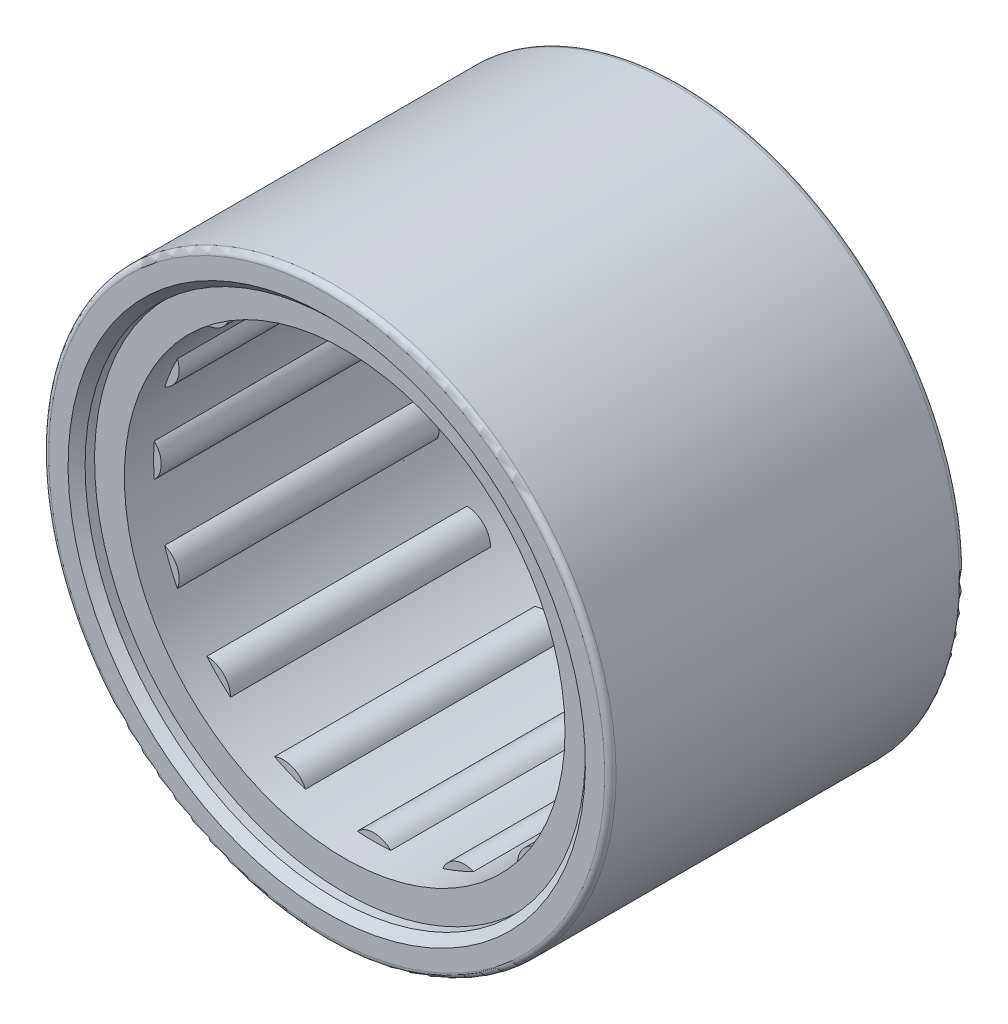
from build123d import *
from build123d.topology import SkipClean

# Parameters (mm, degrees)
SKETCH2_W           = 11.641666666
SKETCH2_H           = 0.79375
SKETCH3_W           = 13.758333334
SKETCH3_H           = 0.264583334
CIRPATTERN1_COUNT   = 16
CIRPATTERN1_ANGLE   = 337.5
FILLET1_R           = 0.254
SKETCH7_R           = 11.641666667
SKETCH7_R_2         = 9.863666667
BOSS_EXTRUDE1_DEPTH = 13.758333333
SKETCH8_R           = 11.197166667
CUT_EXTRUDE1_DEPTH  = 24.970724451
CHAMFER1_SIZE       = 0.381
BOSS_EXTRUDE3_START = 0.254
SKETCH10_R          = 11.197166667
SKETCH10_R_2        = 9.863666667
BOSS_EXTRUDE3_DEPTH = 0.254
CUT_EXTRUDE2_DEPTH  = 11.641666667
CIRPATTERN2_COUNT   = 16
BOSS_EXTRUDE4_START = -1.058333
SKETCH12_R          = 11.197166667
SKETCH12_R_2        = 9.863666667
BOSS_EXTRUDE4_DEPTH = 1.058333


with BuildPart() as part:
    # Sketch1 → Revolve1 (revolve)
    with BuildSketch(Plane(origin=(0, 0, 0), x_dir=(0, 0, -1), z_dir=(1, 0, 0)), mode=Mode.PRIVATE) as revolve1_sk:
        Polygon((-7.9375, 12.7), (7.9375, 12.7), (7.9375, 10.054166667), (6.879166667, 10.054166667), (6.879166667, 11.641666667), (-6.879166667, 11.641666667), (-6.879166667, 10.054166667), (-7.9375, 10.054166667), align=None)
    revolve(revolve1_sk.sketch.rotate(Axis((0, 0, 7.9375), (0, 0, -1)), 180), axis=Axis((0, 0, 7.9375), (0, 0, -1)))

    # Fillet1
    fillet1_edges = [part.edges().sort_by_distance(p)[0] for p in [
        (0, 12.7, 7.9375),
        (0, 12.7, -7.9375),
    ]]
    fillet(fillet1_edges, radius=FILLET1_R)

    # Sketch8 → Cut-Extrude1 (cut, through all)
    with BuildSketch(Plane.XY.offset(7.9375)):
        Circle(SKETCH8_R)
    extrude(amount=-CUT_EXTRUDE1_DEPTH, mode=Mode.SUBTRACT)

    # Chamfer1
    chamfer1_edges = [part.edges().sort_by_distance(p)[0] for p in [
        (-11.197166667, 0, 7.9375),
    ]]
    chamfer(chamfer1_edges, length=CHAMFER1_SIZE)

    # Sketch12 → Boss-Extrude4 (add)
    with BuildSketch(Plane(origin=(0, 0, -7.9375), x_dir=(-1, 0, 0), z_dir=(0, 0, -1)).offset(BOSS_EXTRUDE4_START)):
        with Locations(Location((0, 0, 0), (0, 0, 90))):
            Circle(SKETCH12_R)
        with Locations(Location((0, 0, 0), (0, 0, 180))):
            Circle(SKETCH12_R_2, mode=Mode.SUBTRACT)
    extrude(amount=BOSS_EXTRUDE4_DEPTH)


with BuildPart() as body_2:
    # Sketch2 → Revolve2 (revolve)
    with BuildSketch(Plane(origin=(0, 0, 0), x_dir=(0, 0, -1), z_dir=(1, 0, 0)), mode=Mode.PRIVATE) as revolve2_sk:
        with Locations((0, 11.244791667)):
            Rectangle(SKETCH2_W, SKETCH2_H)
    revolve(revolve2_sk.sketch.rotate(Axis((0, 10.583333333, 5.820833333), (0, 0, -1)), 180), axis=Axis((0, 10.583333333, 5.820833333), (0, 0, -1)))


with BuildPart() as body_3:
    # Sketch3 → Revolve3 (revolve)
    with BuildSketch(Plane(origin=(0, 0, 0), x_dir=(0, 0, -1), z_dir=(1, 0, 0)), mode=Mode.PRIVATE) as revolve3_sk:
        with Locations((0, 10.715625)):
            Rectangle(SKETCH3_W, SKETCH3_H)
    revolve(revolve3_sk.sketch.rotate(Axis((0, 10.583333333, 6.879166667), (0, 0, -1)), 90), axis=Axis((0, 10.583333333, 6.879166667), (0, 0, -1)))


with BuildPart() as cirpattern1_1:
    # CirPattern1: pattern copy
    add(body_2.part.rotate(Axis((0, 0, -7.9375), (0, 0, 1)), 1 * CIRPATTERN1_ANGLE / (CIRPATTERN1_COUNT - 1)))


with BuildPart() as cirpattern1_2:
    # CirPattern1: pattern copy
    add(body_2.part.rotate(Axis((0, 0, -7.9375), (0, 0, 1)), 2 * CIRPATTERN1_ANGLE / (CIRPATTERN1_COUNT - 1)))


with BuildPart() as cirpattern1_3:
    # CirPattern1: pattern copy
    add(body_2.part.rotate(Axis((0, 0, -7.9375), (0, 0, 1)), 3 * CIRPATTERN1_ANGLE / (CIRPATTERN1_COUNT - 1)))


with BuildPart() as cirpattern1_4:
    # CirPattern1: pattern copy
    add(body_2.part.rotate(Axis((0, 0, -7.9375), (0, 0, 1)), 4 * CIRPATTERN1_ANGLE / (CIRPATTERN1_COUNT - 1)))


with BuildPart() as cirpattern1_5:
    # CirPattern1: pattern copy
    add(body_2.part.rotate(Axis((0, 0, -7.9375), (0, 0, 1)), 5 * CIRPATTERN1_ANGLE / (CIRPATTERN1_COUNT - 1)))


with BuildPart() as cirpattern1_6:
    # CirPattern1: pattern copy
    add(body_2.part.rotate(Axis((0, 0, -7.9375), (0, 0, 1)), 6 * CIRPATTERN1_ANGLE / (CIRPATTERN1_COUNT - 1)))


with BuildPart() as cirpattern1_7:
    # CirPattern1: pattern copy
    add(body_2.part.rotate(Axis((0, 0, -7.9375), (0, 0, 1)), 7 * CIRPATTERN1_ANGLE / (CIRPATTERN1_COUNT - 1)))


with BuildPart() as cirpattern1_8:
    # CirPattern1: pattern copy
    add(body_2.part.rotate(Axis((0, 0, -7.9375), (0, 0, 1)), 8 * CIRPATTERN1_ANGLE / (CIRPATTERN1_COUNT - 1)))


with BuildPart() as cirpattern1_9:
    # CirPattern1: pattern copy
    add(body_2.part.rotate(Axis((0, 0, -7.9375), (0, 0, 1)), 9 * CIRPATTERN1_ANGLE / (CIRPATTERN1_COUNT - 1)))


with BuildPart() as cirpattern1_10:
    # CirPattern1: pattern copy
    add(body_2.part.rotate(Axis((0, 0, -7.9375), (0, 0, 1)), 10 * CIRPATTERN1_ANGLE / (CIRPATTERN1_COUNT - 1)))


with BuildPart() as cirpattern1_11:
    # CirPattern1: pattern copy
    add(body_2.part.rotate(Axis((0, 0, -7.9375), (0, 0, 1)), 11 * CIRPATTERN1_ANGLE / (CIRPATTERN1_COUNT - 1)))


with BuildPart() as cirpattern1_12:
    # CirPattern1: pattern copy
    add(body_2.part.rotate(Axis((0, 0, -7.9375), (0, 0, 1)), 12 * CIRPATTERN1_ANGLE / (CIRPATTERN1_COUNT - 1)))


with BuildPart() as cirpattern1_13:
    # CirPattern1: pattern copy
    add(body_2.part.rotate(Axis((0, 0, -7.9375), (0, 0, 1)), 13 * CIRPATTERN1_ANGLE / (CIRPATTERN1_COUNT - 1)))


with BuildPart() as cirpattern1_14:
    # CirPattern1: pattern copy
    add(body_2.part.rotate(Axis((0, 0, -7.9375), (0, 0, 1)), 14 * CIRPATTERN1_ANGLE / (CIRPATTERN1_COUNT - 1)))


with BuildPart() as cirpattern1_15:
    # CirPattern1: pattern copy
    add(body_2.part.rotate(Axis((0, 0, -7.9375), (0, 0, 1)), 15 * CIRPATTERN1_ANGLE / (CIRPATTERN1_COUNT - 1)))


with BuildPart() as cirpattern1_16:
    # CirPattern1: pattern copy
    add(body_3.part.rotate(Axis((0, 0, -7.9375), (0, 0, 1)), 1 * CIRPATTERN1_ANGLE / (CIRPATTERN1_COUNT - 1)))


with BuildPart() as cirpattern1_17:
    # CirPattern1: pattern copy
    add(body_3.part.rotate(Axis((0, 0, -7.9375), (0, 0, 1)), 2 * CIRPATTERN1_ANGLE / (CIRPATTERN1_COUNT - 1)))


with BuildPart() as cirpattern1_18:
    # CirPattern1: pattern copy
    add(body_3.part.rotate(Axis((0, 0, -7.9375), (0, 0, 1)), 3 * CIRPATTERN1_ANGLE / (CIRPATTERN1_COUNT - 1)))


with BuildPart() as cirpattern1_19:
    # CirPattern1: pattern copy
    add(body_3.part.rotate(Axis((0, 0, -7.9375), (0, 0, 1)), 4 * CIRPATTERN1_ANGLE / (CIRPATTERN1_COUNT - 1)))


with BuildPart() as cirpattern1_20:
    # CirPattern1: pattern copy
    add(body_3.part.rotate(Axis((0, 0, -7.9375), (0, 0, 1)), 5 * CIRPATTERN1_ANGLE / (CIRPATTERN1_COUNT - 1)))


with BuildPart() as cirpattern1_21:
    # CirPattern1: pattern copy
    add(body_3.part.rotate(Axis((0, 0, -7.9375), (0, 0, 1)), 6 * CIRPATTERN1_ANGLE / (CIRPATTERN1_COUNT - 1)))


with BuildPart() as cirpattern1_22:
    # CirPattern1: pattern copy
    add(body_3.part.rotate(Axis((0, 0, -7.9375), (0, 0, 1)), 7 * CIRPATTERN1_ANGLE / (CIRPATTERN1_COUNT - 1)))


with BuildPart() as cirpattern1_23:
    # CirPattern1: pattern copy
    add(body_3.part.rotate(Axis((0, 0, -7.9375), (0, 0, 1)), 8 * CIRPATTERN1_ANGLE / (CIRPATTERN1_COUNT - 1)))


with BuildPart() as cirpattern1_24:
    # CirPattern1: pattern copy
    add(body_3.part.rotate(Axis((0, 0, -7.9375), (0, 0, 1)), 9 * CIRPATTERN1_ANGLE / (CIRPATTERN1_COUNT - 1)))


with BuildPart() as cirpattern1_25:
    # CirPattern1: pattern copy
    add(body_3.part.rotate(Axis((0, 0, -7.9375), (0, 0, 1)), 10 * CIRPATTERN1_ANGLE / (CIRPATTERN1_COUNT - 1)))


with BuildPart() as cirpattern1_26:
    # CirPattern1: pattern copy
    add(body_3.part.rotate(Axis((0, 0, -7.9375), (0, 0, 1)), 11 * CIRPATTERN1_ANGLE / (CIRPATTERN1_COUNT - 1)))


with BuildPart() as cirpattern1_27:
    # CirPattern1: pattern copy
    add(body_3.part.rotate(Axis((0, 0, -7.9375), (0, 0, 1)), 12 * CIRPATTERN1_ANGLE / (CIRPATTERN1_COUNT - 1)))


with BuildPart() as cirpattern1_28:
    # CirPattern1: pattern copy
    add(body_3.part.rotate(Axis((0, 0, -7.9375), (0, 0, 1)), 13 * CIRPATTERN1_ANGLE / (CIRPATTERN1_COUNT - 1)))


with BuildPart() as cirpattern1_29:
    # CirPattern1: pattern copy
    add(body_3.part.rotate(Axis((0, 0, -7.9375), (0, 0, 1)), 14 * CIRPATTERN1_ANGLE / (CIRPATTERN1_COUNT - 1)))


with BuildPart() as cirpattern1_30:
    # CirPattern1: pattern copy
    add(body_3.part.rotate(Axis((0, 0, -7.9375), (0, 0, 1)), 15 * CIRPATTERN1_ANGLE / (CIRPATTERN1_COUNT - 1)))


with BuildPart() as body_34:
    # Sketch7 → Boss-Extrude1 (new body)
    with BuildSketch(Plane(origin=(0, 0, 6.879166667), x_dir=(-1, 0, 0), z_dir=(0, 0, -1))):
        with Locations(Location((0, 0, 0), (0, 0, 90))):
            Circle(SKETCH7_R)
        with Locations(Location((0, 0, 0), (0, 0, 90))):
            Circle(SKETCH7_R_2, mode=Mode.SUBTRACT)
    extrude(amount=BOSS_EXTRUDE1_DEPTH)

    # Sketch10 → Boss-Extrude3 (add)
    with SkipClean():  # the faces are left unmerged after this step: merging them gives an invalid solid
        with BuildSketch(Plane.XY.offset(6.879166667).offset(BOSS_EXTRUDE3_START)):
            with Locations(Location((0, 0, 0), (0, 0, 90))):
                Circle(SKETCH10_R)
            Circle(SKETCH10_R_2, mode=Mode.SUBTRACT)
        extrude(amount=-BOSS_EXTRUDE3_DEPTH)

    # Sketch11 → Cut-Extrude2 (cut)
    with SkipClean():  # the faces are left unmerged after this step: merging them gives an invalid solid
        with BuildSketch(Plane.XY.offset(5.820833333)):
            with BuildLine():
                Line((-1.058333333, 10.583333333), (-1.058333333, 12.7))
                Line((-1.058333333, 12.7), (1.058333333, 12.7))
                Line((1.058333333, 12.7), (1.058333333, 10.583333333))
                ThreePointArc((1.058333333, 10.583333333), (0, 9.525), (-1.058333333, 10.583333333))
            make_face()
        cut_extrude2 = extrude(amount=-CUT_EXTRUDE2_DEPTH, mode=Mode.SUBTRACT)

    # CirPattern2: Cut-Extrude2 ×16 about axis
    with SkipClean():  # the faces are left unmerged after this step: merging them gives an invalid solid
        cirpattern2_axis = Axis((0, 0, 0), (0, 0, 1))
        for i in range(1, CIRPATTERN2_COUNT):
            add(cut_extrude2.rotate(cirpattern2_axis, i * 360 / CIRPATTERN2_COUNT), mode=Mode.SUBTRACT)


solid = Compound([part.part, body_2.part, body_3.part, cirpattern1_1.part, cirpattern1_2.part, cirpattern1_3.part, cirpattern1_4.part, cirpattern1_5.part, cirpattern1_6.part, cirpattern1_7.part, cirpattern1_8.part, cirpattern1_9.part, cirpattern1_10.part, cirpattern1_11.part, cirpattern1_12.part, cirpattern1_13.part, cirpattern1_14.part, cirpattern1_15.part, cirpattern1_16.part, cirpattern1_17.part, cirpattern1_18.part, cirpattern1_19.part, cirpattern1_20.part, cirpattern1_21.part, cirpattern1_22.part, cirpattern1_23.part, cirpattern1_24.part, cirpattern1_25.part, cirpattern1_26.part, cirpattern1_27.part, cirpattern1_28.part, cirpattern1_29.part, cirpattern1_30.part, body_34.part])
